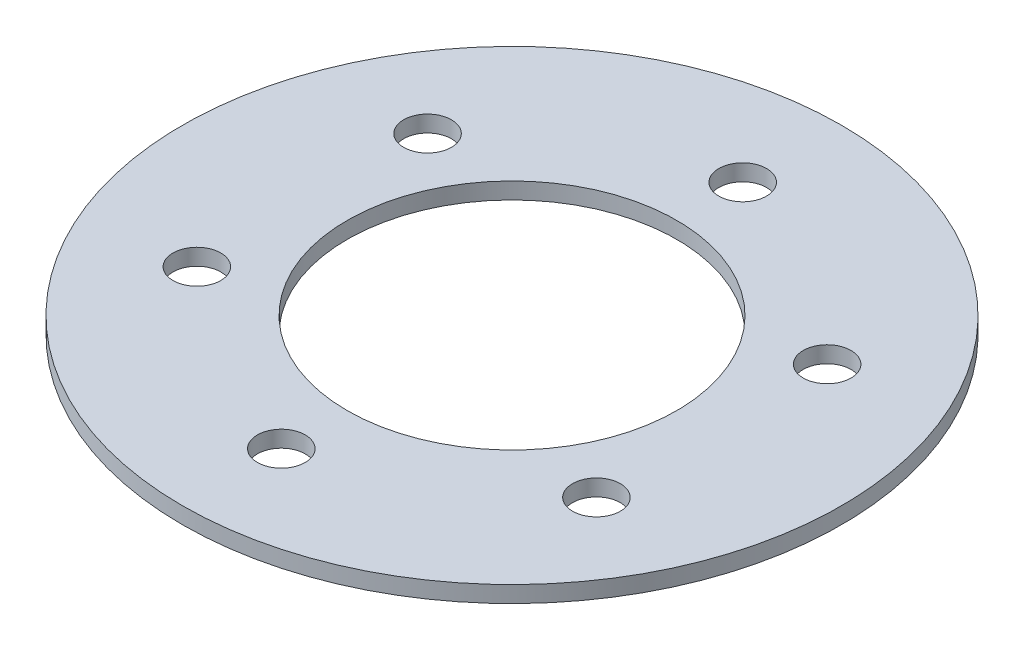
from build123d import *

# Parameters (mm, degrees)
SKETCH_1_R      = 20
SKETCH_1_R_2    = 1.45
SKETCH_1_R_3    = 10
EXTRUDE_1_DEPTH = 1


with BuildPart() as part:
    # 草图1 → 凸台-拉伸1 (new body)
    with BuildSketch(Plane(origin=(0, 0, 0), x_dir=(1, 0, 0), z_dir=(0, 1, 0))):
        with Locations(Location((0, 0, 0), (0, 0, 270))):
            Circle(SKETCH_1_R)
        with Locations(Location((0, 14, 0), (0, 0, 270))):
            Circle(SKETCH_1_R_2, mode=Mode.SUBTRACT)
        with Locations(Location((-12.124355653, 7, 0), (0, 0, 270))):
            Circle(SKETCH_1_R_2, mode=Mode.SUBTRACT)
        with Locations(Location((-12.124355653, -7, 0), (0, 0, 270))):
            Circle(SKETCH_1_R_2, mode=Mode.SUBTRACT)
        with Locations(Location((0, -14, 0), (0, 0, 270))):
            Circle(SKETCH_1_R_2, mode=Mode.SUBTRACT)
        with Locations(Location((12.124355653, -7, 0), (0, 0, 270))):
            Circle(SKETCH_1_R_2, mode=Mode.SUBTRACT)
        with Locations(Location((12.124355653, 7, 0), (0, 0, 270))):
            Circle(SKETCH_1_R_2, mode=Mode.SUBTRACT)
        with Locations(Location((0, 0, 0), (0, 0, 270))):
            Circle(SKETCH_1_R_3, mode=Mode.SUBTRACT)
    extrude(amount=EXTRUDE_1_DEPTH)


solid = part.part
